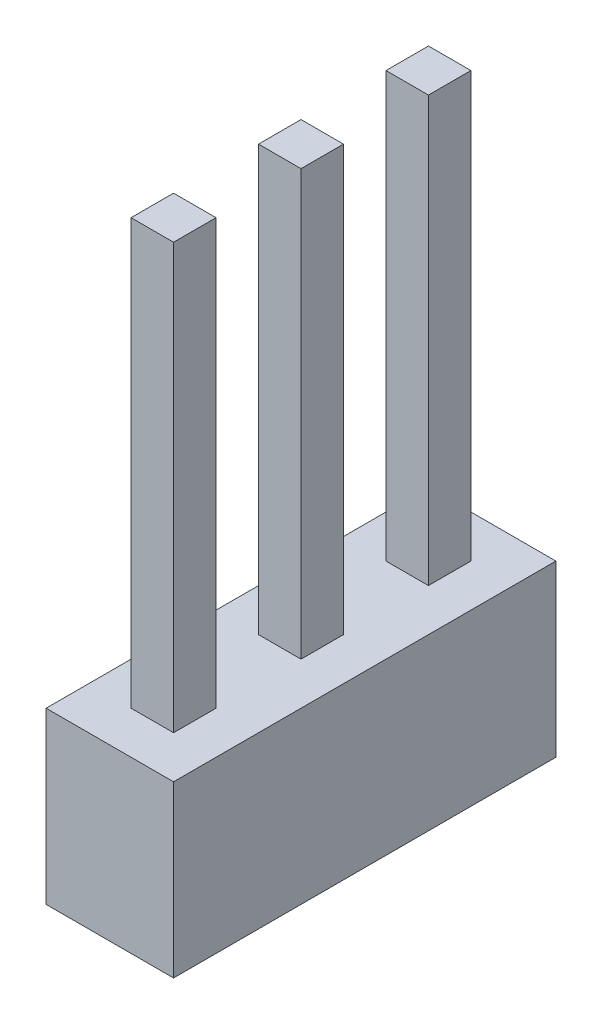
from build123d import *

# Parameters (mm, degrees)
SKETCH1_W      = 2.286
SKETCH1_H      = 6.858
EXTRUDE1_DEPTH = 3.048
SKETCH2_W      = 0.762
SKETCH2_H      = 0.762
EXTRUDE2_DEPTH = 7.62


with BuildPart() as part:
    # Sketch1 → Extrude1 (new body)
    with BuildSketch(Plane(origin=(0, 0, 0), x_dir=(1, 0, 0), z_dir=(0, 1, 0))):
        with Locations((1.143, 3.429)):
            Rectangle(SKETCH1_W, SKETCH1_H)
    extrude(amount=EXTRUDE1_DEPTH)

    # Sketch2 → Extrude2 (add)
    with BuildSketch(Plane(origin=(0, 3.048, 0), x_dir=(1, 0, 0), z_dir=(0, 1, 0))):
        with Locations((1.143, 1.143)):
            Rectangle(SKETCH2_W, SKETCH2_H)
        with Locations((1.143, 5.715)):
            Rectangle(SKETCH2_W, SKETCH2_H)
        with Locations((1.143, 3.429)):
            Rectangle(SKETCH2_W, SKETCH2_H)
    extrude(amount=EXTRUDE2_DEPTH)


solid = part.part
